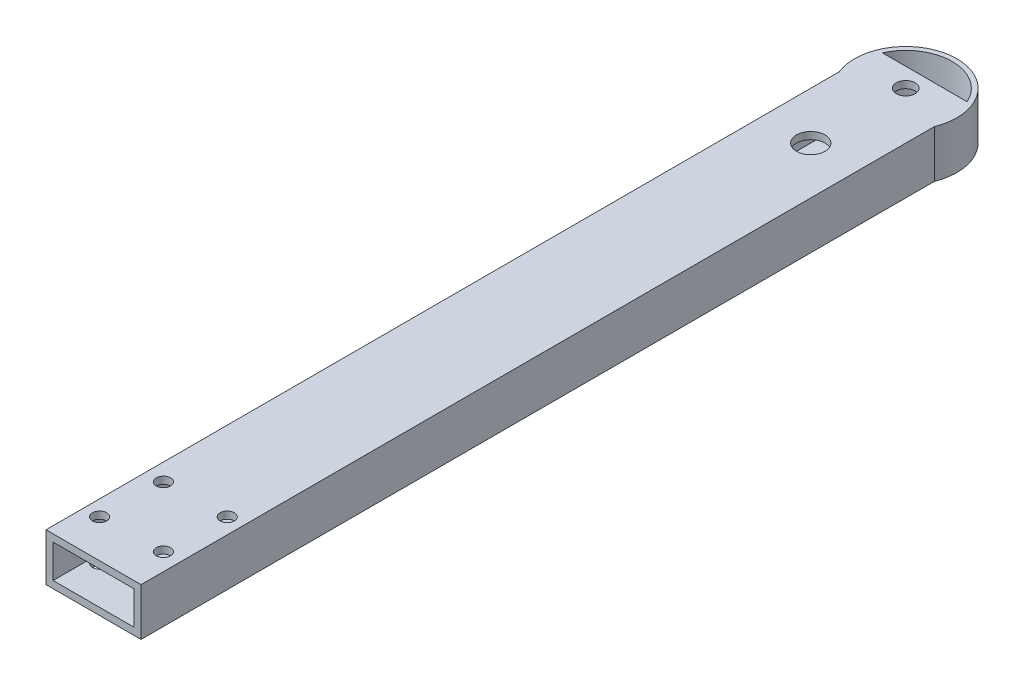
from build123d import *

# Parameters (mm, degrees)
SKETCH1_W           = 20
SKETCH1_H           = 10
SKETCH1_W_2         = 17
SKETCH1_H_2         = 7
BOSS_EXTRUDE1_DEPTH = 175
SKETCH2_R           = 1.5
CUT_EXTRUDE1_DEPTH  = 176.570498661
SKETCH3_R           = 2
SKETCH3_R_2         = 3
CUT_EXTRUDE2_DEPTH  = 176.570498661
SKETCH5_R           = 10.770329614
SKETCH5_R_2         = 9.770329614
BOSS_EXTRUDE2_DEPTH = 10


with BuildPart() as part:
    # Sketch1 → Boss-Extrude1 (new body)
    with BuildSketch(Plane.XY):
        Rectangle(SKETCH1_W, SKETCH1_H)
        Rectangle(SKETCH1_W_2, SKETCH1_H_2, mode=Mode.SUBTRACT)
    extrude(amount=BOSS_EXTRUDE1_DEPTH)

    # Sketch2 → Cut-Extrude1 (cut, through all)
    with BuildSketch(Plane(origin=(0, 5, 0), x_dir=(1, 0, 0), z_dir=(0, 1, 0))):
        with Locations((6.363961031, -166.646446609)):
            Circle(SKETCH2_R)
        with Locations((-6.717514421, -167)):
            Circle(SKETCH2_R)
        with Locations((6.717514421, -153.564971157)):
            Circle(SKETCH2_R)
        with Locations((-6.363961031, -153.918524548)):
            Circle(SKETCH2_R)
    extrude(amount=-CUT_EXTRUDE1_DEPTH, mode=Mode.SUBTRACT)

    # Sketch3 → Cut-Extrude2 (cut, through all)
    with BuildSketch(Plane(origin=(0, 5, 0), x_dir=(1, 0, 0), z_dir=(0, 1, 0))):
        with Locations((0, -4)):
            Circle(SKETCH3_R)
        with Locations((0, -24)):
            Circle(SKETCH3_R_2)
    extrude(amount=-CUT_EXTRUDE2_DEPTH, mode=Mode.SUBTRACT)

    # Sketch5 → Boss-Extrude2 (add)
    with BuildSketch(Plane(origin=(0, 5, 0), x_dir=(1, 0, 0), z_dir=(0, 1, 0))):
        with Locations((0, -4)):
            Circle(SKETCH5_R)
        with Locations((0, -4)):
            Circle(SKETCH5_R_2, mode=Mode.SUBTRACT)
    extrude(amount=-BOSS_EXTRUDE2_DEPTH)


solid = part.part
